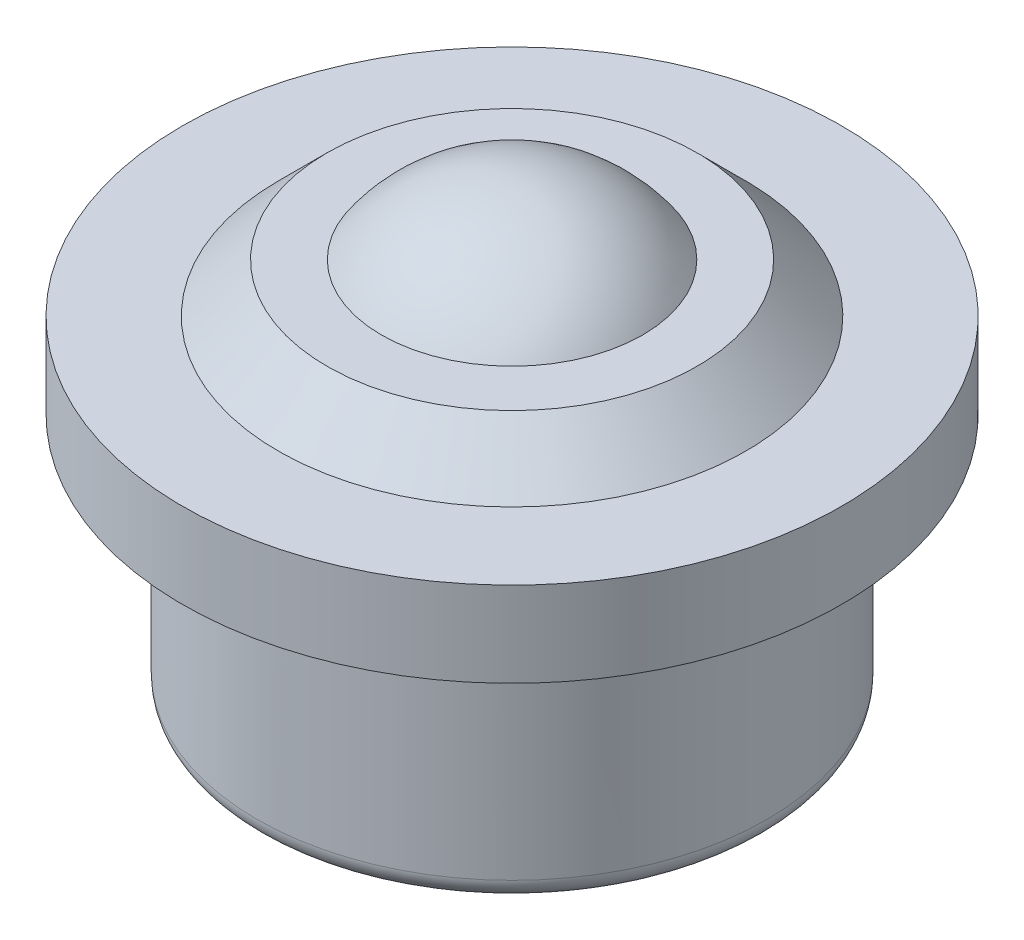
from build123d import *

# Parameters (mm, degrees)
FILLET1_R = 1


with BuildPart() as part:
    # Esquisse1 → Révolution1 (revolve)
    with BuildSketch(Plane.XY):
        with BuildLine():
            Line((-12, -2), (-15.5, -2))
            Line((-15.5, -2), (-15.5, 2))
            Line((-15.5, 2), (-11, 2))
            Line((-11, 2), (-8.7, 4.3))
            Line((-8.7, 4.3), (-6.144916598, 4.3))
            ThreePointArc((-6.144916598, 4.3), (-3.464101615, 6.652067348), (0, 7.5))
            Line((0, 7.5), (0, -13.5))
            Line((0, -13.5), (-12, -13.5))
            Line((-12, -13.5), (-12, -12))
            Line((-12, -12), (-12, -2))
        make_face()
    revolve(axis=Axis((0, 7.5, 0), (0, -1, 0)))

    # Fillet1
    fillet1_edges = [part.edges().sort_by_distance(p)[0] for p in [
        (12, -13.5, 0),
    ]]
    fillet(fillet1_edges, radius=FILLET1_R)


solid = part.part
